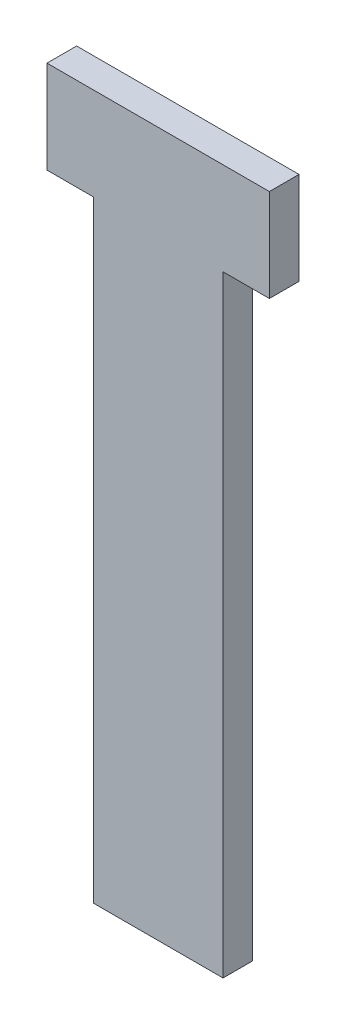
from build123d import *

# Parameters (mm, degrees)
ESTRUSIONE_ESTRUSIONE1_DEPTH = 1.6


with BuildPart() as part:
    # Schizzo1 → Estrusione-Estrusione1 (new body)
    with BuildSketch(Plane.XY):
        Polygon((-3.5, 33), (-6, 33), (-6, 38), (6, 38), (6, 33), (3.5, 33), (3.5, 0), (-3.5, 0), align=None)
    extrude(amount=ESTRUSIONE_ESTRUSIONE1_DEPTH)


solid = part.part
